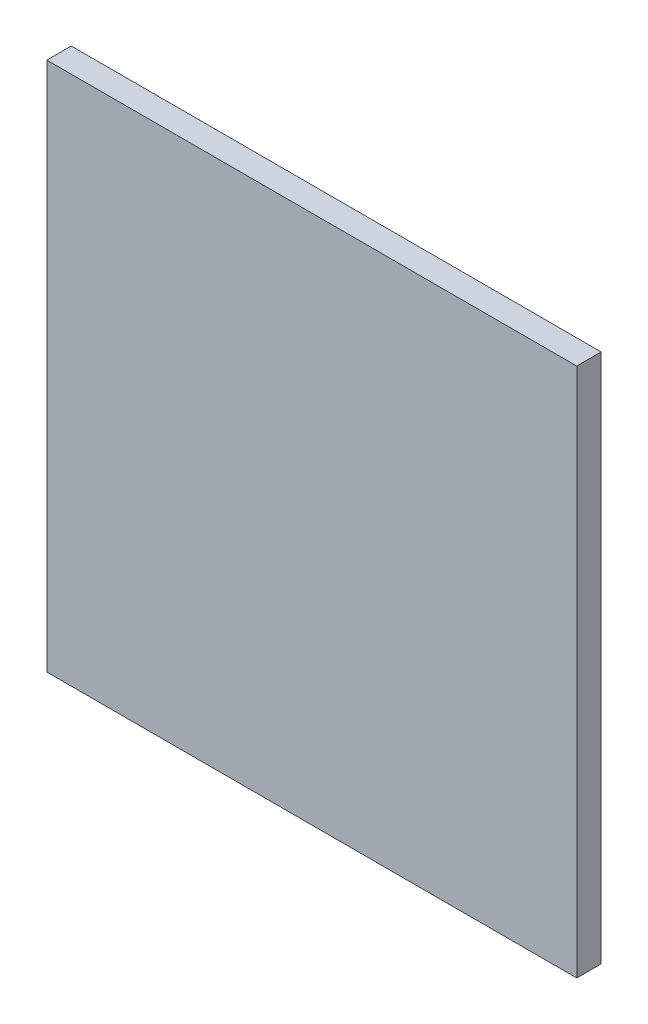
from build123d import *

# Parameters (mm, degrees)
SKETCH2_W           = 71.17
SKETCH2_H           = 71.17
BOSS_EXTRUDE1_DEPTH = 3.28


with BuildPart() as part:
    # Sketch2 → Boss-Extrude1 (new body)
    with BuildSketch(Plane.XY):
        Rectangle(SKETCH2_W, SKETCH2_H)
    extrude(amount=BOSS_EXTRUDE1_DEPTH)


solid = part.part
